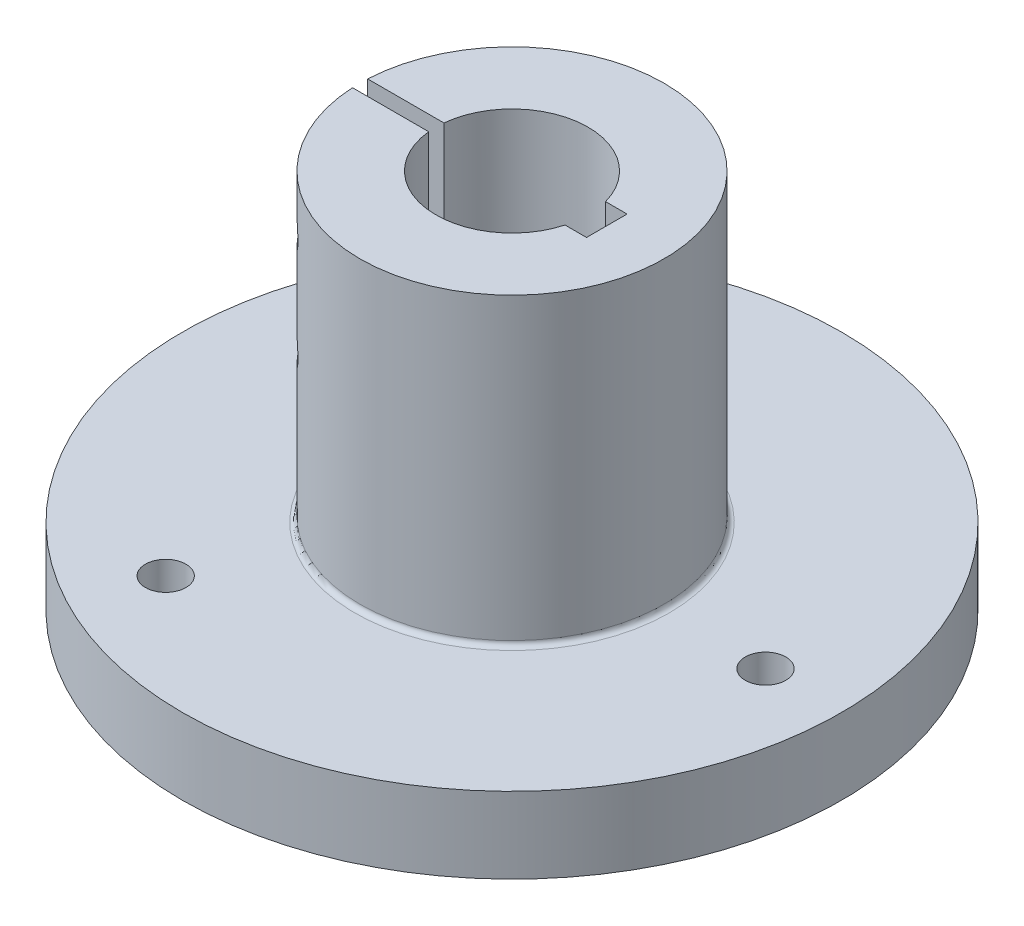
from build123d import *

# Parameters (mm, degrees)
SKETCH3_R           = 4
BOSS_EXTRUDE1_DEPTH = 15
BOSS_EXTRUDE2_DEPTH = 60
FILLET1_R           = 1
SKETCH6_R           = 3.4
CUT_EXTRUDE1_DEPTH  = 116.10446612
SKETCH7_R           = 4
CUT_EXTRUDE2_DEPTH  = 116.10446612
CUT_EXTRUDE3_START  = -6
SKETCH8_R           = 7
CUT_EXTRUDE3_DEPTH  = 110.10446612
BOSS_EXTRUDE3_DEPTH = 15


with BuildPart() as part:
    # Sketch3 → Boss-Extrude1 (new body)
    with BuildSketch(Plane(origin=(0, 0, 0), x_dir=(1, 0, 0), z_dir=(0, 1, 0))):
        with BuildLine():
            ThreePointArc((52.056720354, -14.858327678), (65, 0), (52.056720354, 14.858327678))
            ThreePointArc((52.056720354, 14.858327678), (15.768189382, 27.311305152), (-13.16067095, 52.511606103))
            ThreePointArc((-13.16067095, 52.511606103), (-32.5, 56.291651246), (-38.896049404, 37.653278425))
            ThreePointArc((-38.896049404, 37.653278425), (-31.536378763, 0), (-38.896049404, -37.653278425))
            ThreePointArc((-38.896049404, -37.653278425), (-32.5, -56.291651246), (-13.16067095, -52.511606103))
            ThreePointArc((-13.16067095, -52.511606103), (15.768189382, -27.311305152), (52.056720354, -14.858327678))
        make_face()
        with Locations(Location((-25, 43.301270189, 0), (0, 0, 270))):
            Circle(SKETCH3_R, mode=Mode.SUBTRACT)
        with Locations(Location((-25, -43.301270189, 0), (0, 0, 270))):
            Circle(SKETCH3_R, mode=Mode.SUBTRACT)
        with Locations(Location((50, 0, 0), (0, 0, 270))):
            Circle(SKETCH3_R, mode=Mode.SUBTRACT)
        with BuildLine():
            Line((18.7, 4), (14.456832295, 4))
            ThreePointArc((14.456832295, 4), (-15, 0), (14.456832295, -4))
            Line((14.456832295, -4), (18.7, -4))
            Line((18.7, -4), (18.7, 4))
        make_face(mode=Mode.SUBTRACT)
    extrude(amount=BOSS_EXTRUDE1_DEPTH)

    # Sketch4 → Boss-Extrude2 (add)
    with BuildSketch(Plane(origin=(0, 15, 0), x_dir=(1, 0, 0), z_dir=(0, 1, 0))):
        with BuildLine():
            Line((18.7, -4), (14.456832295, -4))
            ThreePointArc((14.456832295, -4), (-1.271711896, -14.945994408), (-14.924811557, -1.5))
            Line((-14.924811557, -1.5), (-29.962476533, -1.5))
            ThreePointArc((-29.962476533, -1.5), (0.750234632, -29.990617666), (30, 0))
            ThreePointArc((30, 0), (0.750234632, 29.990617666), (-29.962476533, 1.5))
            Line((-29.962476533, 1.5), (-14.924811557, 1.5))
            ThreePointArc((-14.924811557, 1.5), (-1.271711896, 14.945994408), (14.456832295, 4))
            Line((14.456832295, 4), (18.7, 4))
            Line((18.7, 4), (18.7, -4))
        make_face()
    extrude(amount=BOSS_EXTRUDE2_DEPTH)

    # Fillet1
    fillet1_edges = [part.edges().sort_by_distance(p)[0] for p in [
        (30, 15, 0),
    ]]
    fillet(fillet1_edges, radius=FILLET1_R)

    # Sketch6 → Cut-Extrude1 (cut, through all)
    with BuildSketch(Plane.XY):
        with Locations(Location((-22.443644045, 65, 0), (0, 0, 180))):
            Circle(SKETCH6_R)
        with Locations(Location((-22.443644045, 45, 0), (0, 0, 180))):
            Circle(SKETCH6_R)
    extrude(amount=CUT_EXTRUDE1_DEPTH, mode=Mode.SUBTRACT)

    # Sketch7 → Cut-Extrude2 (cut, through all)
    with BuildSketch(Plane.XY):
        with Locations((-22.443644045, 65)):
            Circle(SKETCH7_R)
        with Locations((-22.443644045, 45)):
            Circle(SKETCH7_R)
    extrude(amount=-CUT_EXTRUDE2_DEPTH, mode=Mode.SUBTRACT)

    # Sketch8 → Cut-Extrude3 (cut, through all)
    with BuildSketch(Plane.XY.offset(CUT_EXTRUDE3_START)):
        with Locations((-22.443644045, 65)):
            Circle(SKETCH8_R)
        with Locations((-22.443644045, 45)):
            Circle(SKETCH8_R)
    extrude(amount=-CUT_EXTRUDE3_DEPTH, mode=Mode.SUBTRACT)

    # Sketch9 → Boss-Extrude3 (add)
    with BuildSketch(Plane(origin=(0, 0, 0), x_dir=(1, 0, 0), z_dir=(0, 1, 0))):
        with BuildLine():
            ThreePointArc((-38.896049404, 37.653278425), (-39.187845088, 48.170053586), (-32.499996308, 56.291653378))
            ThreePointArc((-32.499996308, 56.291653378), (-65, 1.908e-06), (-32.499999613, -56.29165147))
            ThreePointArc((-32.499999613, -56.29165147), (-39.187845707, -48.170051781), (-38.896049404, -37.653278425))
            ThreePointArc((-38.896049404, -37.653278425), (-31.536378763, 0), (-38.896049404, 37.653278425))
        make_face()
        with BuildLine():
            ThreePointArc((52.056720354, 14.858327678), (61.310411251, 9.85264418), (65, 0))
            ThreePointArc((65, 0), (32.500001846, 56.29165018), (-32.499996308, 56.291653378))
            ThreePointArc((-32.499996308, 56.291653378), (-22.122563378, 58.022695341), (-13.16067095, 52.511606103))
            ThreePointArc((-13.16067095, 52.511606103), (15.768189382, 27.311305152), (52.056720354, 14.858327678))
        make_face()
        with BuildLine():
            ThreePointArc((-32.499999613, -56.29165147), (32.500000194, -56.291651134), (65, 0))
            ThreePointArc((65, 0), (61.310411251, -9.85264418), (52.056720354, -14.858327678))
            ThreePointArc((52.056720354, -14.858327678), (15.768189382, -27.311305152), (-13.16067095, -52.511606103))
            ThreePointArc((-13.16067095, -52.511606103), (-22.122565251, -58.022695707), (-32.499999613, -56.29165147))
        make_face()
    extrude(amount=BOSS_EXTRUDE3_DEPTH)


solid = part.part
